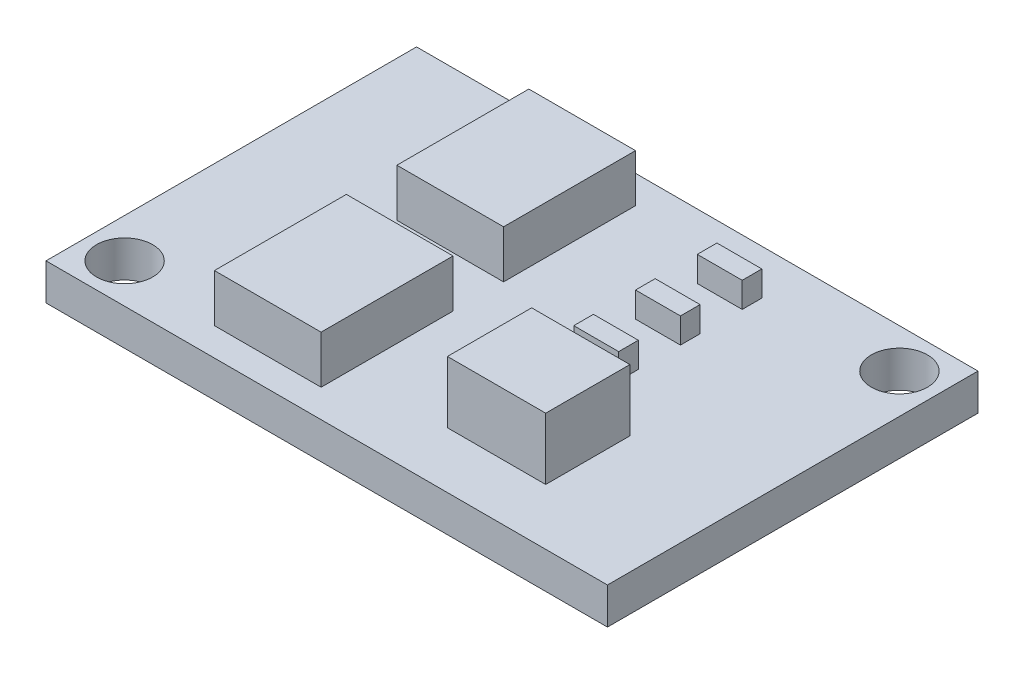
from build123d import *

# Parameters (mm, degrees)
SKETCH_1_W      = 20
SKETCH_1_H      = 13.2
SKETCH_1_R      = 1
EXTRUDE_1_DEPTH = 1.3
SKETCH_1_3_W    = 3.8
SKETCH_1_3_H    = 4.7
EXTRUDE_2_DEPTH = 3
SKETCH_1_4_W    = 1.6
SKETCH_1_4_H    = 0.7
EXTRUDE_3_DEPTH = 2.2
SKETCH_1_5_W    = 3.5
SKETCH_1_5_H    = 3
EXTRUDE_4_DEPTH = 3.5


with BuildPart() as part:
    # 草图1 → 凸台-拉伸1 (new body)
    with BuildSketch(Plane(origin=(0, 0, 0), x_dir=(1, 0, 0), z_dir=(0, 1, 0))):
        Rectangle(SKETCH_1_W, SKETCH_1_H)
        with Locations((-8.6, -5.2)):
            Circle(SKETCH_1_R, mode=Mode.SUBTRACT)
        with Locations((8.6, 5.2)):
            Circle(SKETCH_1_R, mode=Mode.SUBTRACT)
    extrude(amount=EXTRUDE_1_DEPTH)

    # 草图1<3> → 凸台-拉伸2 (add)
    with BuildSketch(Plane(origin=(0, 0, 0), x_dir=(1, 0, 0), z_dir=(0, 1, 0))):
        with Locations((-3.1, 3.25)):
            Rectangle(SKETCH_1_3_W, SKETCH_1_3_H)
        with Locations((-3.1, -3.25)):
            Rectangle(SKETCH_1_3_W, SKETCH_1_3_H)
    extrude(amount=EXTRUDE_2_DEPTH)

    # 草图1<4> → 凸台-拉伸3 (add)
    with BuildSketch(Plane(origin=(0, 0, 0), x_dir=(1, 0, 0), z_dir=(0, 1, 0))):
        with Locations((3.1, 4.65)):
            Rectangle(SKETCH_1_4_W, SKETCH_1_4_H)
        with Locations((3.1, 2.45)):
            Rectangle(SKETCH_1_4_W, SKETCH_1_4_H)
        with Locations((3.1, 0.25)):
            Rectangle(SKETCH_1_4_W, SKETCH_1_4_H)
    extrude(amount=EXTRUDE_3_DEPTH)

    # 草图1<5> → 凸台-拉伸4 (add)
    with BuildSketch(Plane(origin=(0, 0, 0), x_dir=(1, 0, 0), z_dir=(0, 1, 0))):
        with Locations((4.05, -3.1)):
            Rectangle(SKETCH_1_5_W, SKETCH_1_5_H)
    extrude(amount=EXTRUDE_4_DEPTH)


solid = part.part
